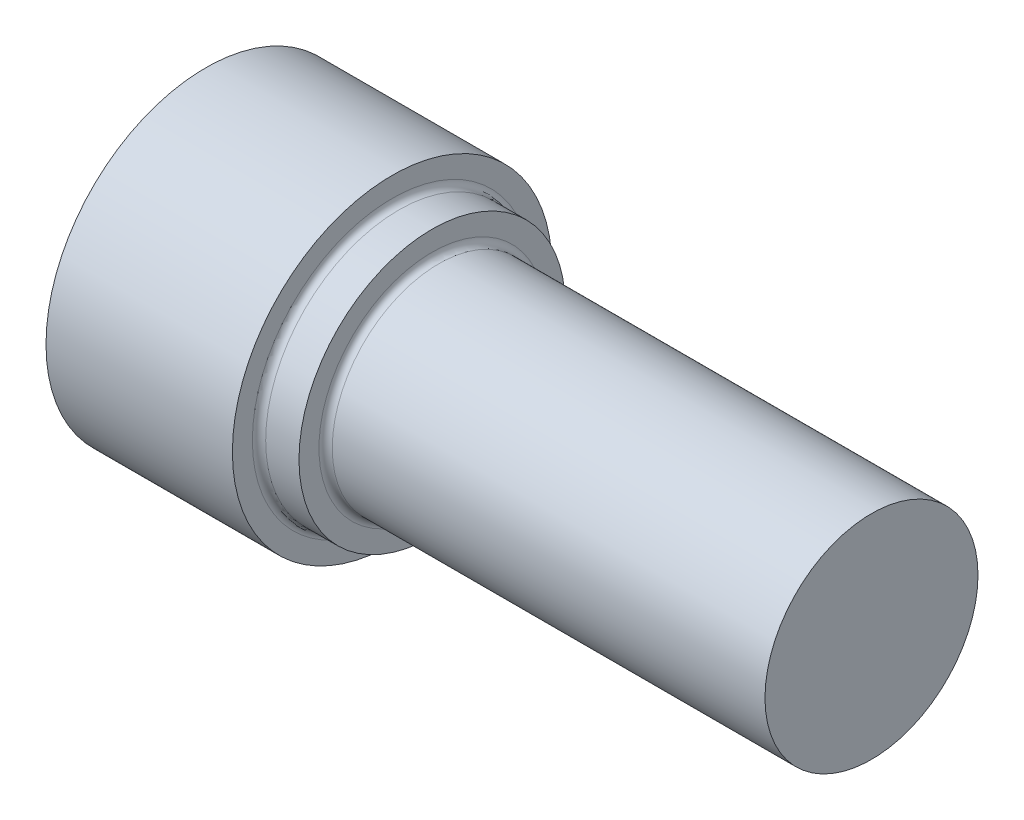
from build123d import *

# Parameters (mm, degrees)
SKETCH1_R           = 12
BOSS_EXTRUDE1_DEPTH = 14
SKETCH2_R           = 10
BOSS_EXTRUDE2_DEPTH = 3
SKETCH3_R           = 8
BOSS_EXTRUDE3_DEPTH = 33
FILLET1_R           = 0.5


with BuildPart() as part:
    # Sketch1 → Boss-Extrude1 (new body)
    with BuildSketch(Plane(origin=(0, 0, 0), x_dir=(0, 0, -1), z_dir=(1, 0, 0))):
        Circle(SKETCH1_R)
    extrude(amount=BOSS_EXTRUDE1_DEPTH)

    # Sketch2 → Boss-Extrude2 (add)
    with BuildSketch(Plane(origin=(14, 0, 0), x_dir=(0, 0, -1), z_dir=(1, 0, 0))):
        Circle(SKETCH2_R)
    extrude(amount=BOSS_EXTRUDE2_DEPTH)

    # Sketch3 → Boss-Extrude3 (add)
    with BuildSketch(Plane(origin=(17, 0, 0), x_dir=(0, 0, -1), z_dir=(1, 0, 0))):
        Circle(SKETCH3_R)
    extrude(amount=BOSS_EXTRUDE3_DEPTH)

    # Fillet1
    fillet1_edges = [part.edges().sort_by_distance(p)[0] for p in [
        (17, 0, 8),
        (14, 0, 10),
    ]]
    fillet(fillet1_edges, radius=FILLET1_R)


solid = part.part
